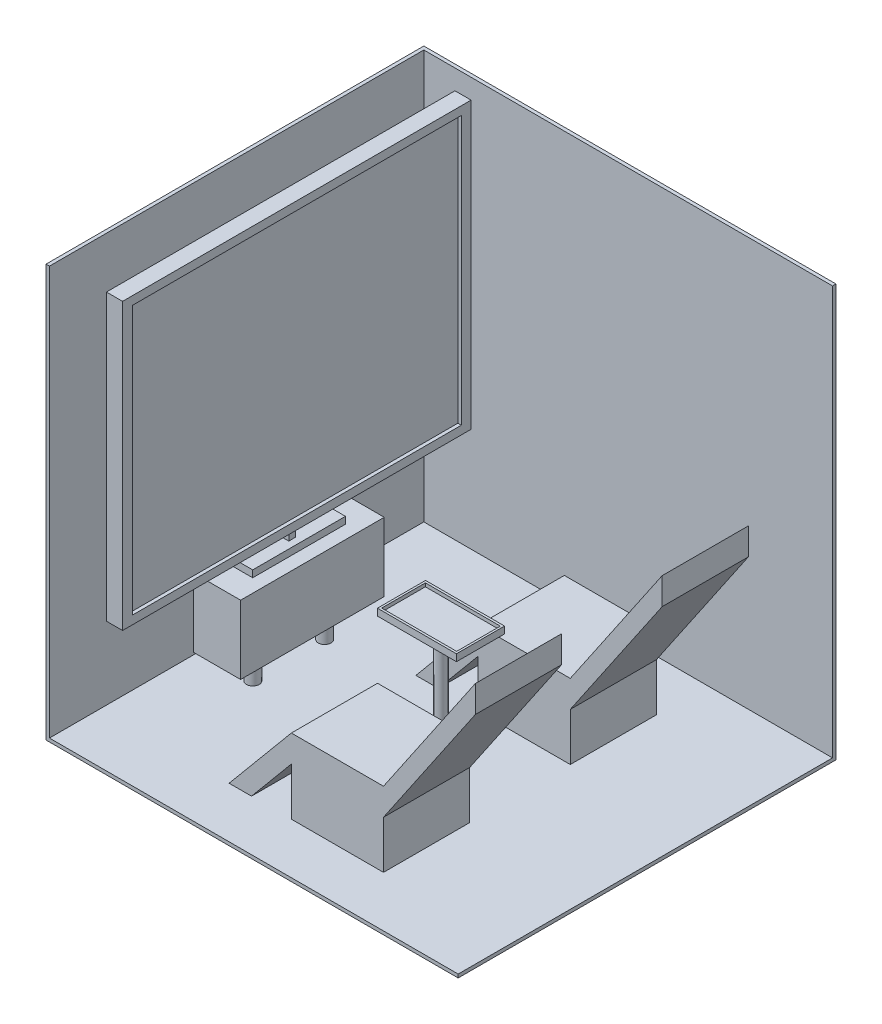
from build123d import *

# Parameters (mm, degrees)
SKETCH_1_W          = 120
SKETCH_1_H          = 110
EXTRUDE_1_DEPTH     = 120
SKETCH_2_W          = 119
SKETCH_2_H          = 119
CUT_EXTRUDE_1_DEPTH = 109
SKETCH_3_W          = 13.76951007
SKETCH_3_H          = 41.816324506
EXTRUDE_2_DEPTH     = 29
SKETCH_3_2_W        = 13.76951007
SKETCH_3_2_H        = 41.816324506
CUT_EXTRUDE_2_DEPTH = 9
SKETCH_6_R          = 1.856942382
EXTRUDE_4_DEPTH     = 9
SKETCH_7_W          = 6
SKETCH_7_H          = 27
EXTRUDE_5_DEPTH     = 2
SKETCH_8_W          = 2
SKETCH_8_H          = 2
EXTRUDE_6_DEPTH     = 3
SKETCH_9_W          = 4.691076501
SKETCH_9_H          = 101.472246916
EXTRUDE_7_DEPTH     = 83
SKETCH_10_W         = 95.77595166
SKETCH_10_H         = 78.098220696
CUT_EXTRUDE_3_DEPTH = 1
SKETCH_11_W         = 71.699562075
SKETCH_11_H         = 25.094846726
EXTRUDE_9_DEPTH     = 61
CUT_EXTRUDE_4_DEPTH = 81
SKETCH_13_R         = 1.5
EXTRUDE_10_DEPTH    = 31
SKETCH_14_W         = 23
SKETCH_14_H         = 14
EXTRUDE_11_DEPTH    = 2
SKETCH_15_W         = 21.829901038
SKETCH_15_H         = 12.722773114
CUT_EXTRUDE_5_DEPTH = 1


with BuildPart() as part:
    # 스케치1 → 보스-돌출1 (new body)
    with BuildSketch(Plane(origin=(0, 0, 0), x_dir=(1, 0, 0), z_dir=(0, 1, 0))):
        Rectangle(SKETCH_1_W, SKETCH_1_H)
    extrude(amount=EXTRUDE_1_DEPTH)

    # 스케치2 → 컷-돌출1 (cut)
    with BuildSketch(Plane.XY.offset(55)):
        with Locations((0.5, 60.5)):
            Rectangle(SKETCH_2_W, SKETCH_2_H)
    extrude(amount=-CUT_EXTRUDE_1_DEPTH, mode=Mode.SUBTRACT)

    # 스케치3 → 보스-돌출2 (add)
    with BuildSketch(Plane(origin=(0, 1, 0), x_dir=(1, 0, 0), z_dir=(0, 1, 0))):
        with Locations((-43.822012207, -0.5)):
            Rectangle(SKETCH_3_W, SKETCH_3_H)
    extrude(amount=EXTRUDE_2_DEPTH)

    # 스케치3<2> → 컷-돌출2 (cut)
    with BuildSketch(Plane(origin=(0, 1, 0), x_dir=(1, 0, 0), z_dir=(0, 1, 0))):
        with Locations((-43.822012207, -0.5)):
            Rectangle(SKETCH_3_2_W, SKETCH_3_2_H)
    extrude(amount=CUT_EXTRUDE_2_DEPTH, mode=Mode.SUBTRACT)


with BuildPart() as cut_extrude_2_piece_1:
    # of the separate pieces the step leaves, piece 1, a body of its own (cut_extrude_2_pieces)
    add(part.part.solids().sort_by_distance((-60, 0, -55))[0])



with BuildPart() as cut_extrude_2_piece_2:
    # of the separate pieces the step leaves, piece 2, a body of its own (cut_extrude_2_pieces)
    add(part.part.solids().sort_by_distance((-50.706767242, 10, -20.408162253))[0])


with BuildPart() as cut_extrude_2_piece_1_1:
    add(cut_extrude_2_piece_1.part)

    add(cut_extrude_2_piece_2.part)  # 보스-돌출4 merges 컷-돌출2 piece 2
    # 스케치6 → 보스-돌출4 (add)
    with BuildSketch(Plane(origin=(0, 1, 0), x_dir=(1, 0, 0), z_dir=(0, 1, 0))):
        with Locations((-43.822012207, 9.954081127)):
            Circle(SKETCH_6_R)
        with Locations((-43.822012207, -10.954081127)):
            Circle(SKETCH_6_R)
    extrude(amount=EXTRUDE_4_DEPTH)



with BuildPart() as body_2:
    # 스케치7 → 보스-돌출5 (new body)
    with BuildSketch(Plane(origin=(0, 30, 0), x_dir=(1, 0, 0), z_dir=(0, 1, 0))):
        with Locations((-43.822012207, -0.5)):
            Rectangle(SKETCH_7_W, SKETCH_7_H)
    extrude(amount=EXTRUDE_5_DEPTH)


with BuildPart() as cut_extrude_2_piece_1_2:
    add(cut_extrude_2_piece_1_1.part)

    add(body_2.part)  # 보스-돌출6 merges body 2
    # 스케치8 → 보스-돌출6 (add)
    with BuildSketch(Plane(origin=(0, 32, 0), x_dir=(1, 0, 0), z_dir=(0, 1, 0))):
        with Locations((-43.822012207, -0.5)):
            Rectangle(SKETCH_8_W, SKETCH_8_H)
    extrude(amount=EXTRUDE_6_DEPTH)

    # 스케치9 → 보스-돌출7 (add)
    with BuildSketch(Plane(origin=(0, 35, 0), x_dir=(1, 0, 0), z_dir=(0, 1, 0))):
        with Locations((-43.822012208, -0.5)):
            Rectangle(SKETCH_9_W, SKETCH_9_H)
    extrude(amount=EXTRUDE_7_DEPTH)

    # 스케치10 → 컷-돌출3 (cut)
    with BuildSketch(Plane(origin=(-41.476473957, 0, 0), x_dir=(0, 0, -1), z_dir=(1, 0, 0))):
        with Locations((-0.5, 76.5)):
            Rectangle(SKETCH_10_W, SKETCH_10_H)
    extrude(amount=-CUT_EXTRUDE_3_DEPTH, mode=Mode.SUBTRACT)

    # 스케치11 → 보스-돌출9 (add)
    with BuildSketch(Plane(origin=(0, 1, 0), x_dir=(1, 0, 0), z_dir=(0, 1, 0))):
        with Locations((14.395545437, -27.691005805)):
            Rectangle(SKETCH_11_W, SKETCH_11_H)
        with Locations((14.395545437, 26.691005805)):
            Rectangle(SKETCH_11_W, SKETCH_11_H)
    extrude(amount=EXTRUDE_9_DEPTH)

    # 스케치12 → 컷-돌출4 (cut)
    with BuildSketch(Plane.XY.offset(40.238429168)):
        Polygon((-21.454235601, 62), (-21.454235601, 1), (-3.329674483, 22.725113556), (23.497466254, 22.725113556), (50.245326474, 62), align=None)
        Polygon((-3.329674483, 14.908243333), (-14.932873043, 1), (-3.329674483, 1), align=None)
        Polygon((23.497466254, 14.908243333), (23.497466254, 1), (50.245326474, 1), (50.245326474, 54.183129777), align=None)
    extrude(amount=-CUT_EXTRUDE_4_DEPTH, mode=Mode.SUBTRACT)

    # 스케치13 → 보스-돌출10 (add)
    with BuildSketch(Plane(origin=(0, 1, 0), x_dir=(1, 0, 0), z_dir=(0, 1, 0))):
        with Locations((0.5, -0.5)):
            Circle(SKETCH_13_R)
    extrude(amount=EXTRUDE_10_DEPTH)

    # 스케치14 → 보스-돌출11 (add)
    with BuildSketch(Plane(origin=(0, 32, 0), x_dir=(1, 0, 0), z_dir=(0, 1, 0))):
        with Locations((0.5, -0.5)):
            Rectangle(SKETCH_14_W, SKETCH_14_H)
    extrude(amount=EXTRUDE_11_DEPTH)

    # 스케치15 → 컷-돌출5 (cut)
    with BuildSketch(Plane(origin=(0, 34, 0), x_dir=(1, 0, 0), z_dir=(0, 1, 0))):
        with Locations((0.5, -0.5)):
            Rectangle(SKETCH_15_W, SKETCH_15_H)
    extrude(amount=-CUT_EXTRUDE_5_DEPTH, mode=Mode.SUBTRACT)


solid = cut_extrude_2_piece_1_2.part
